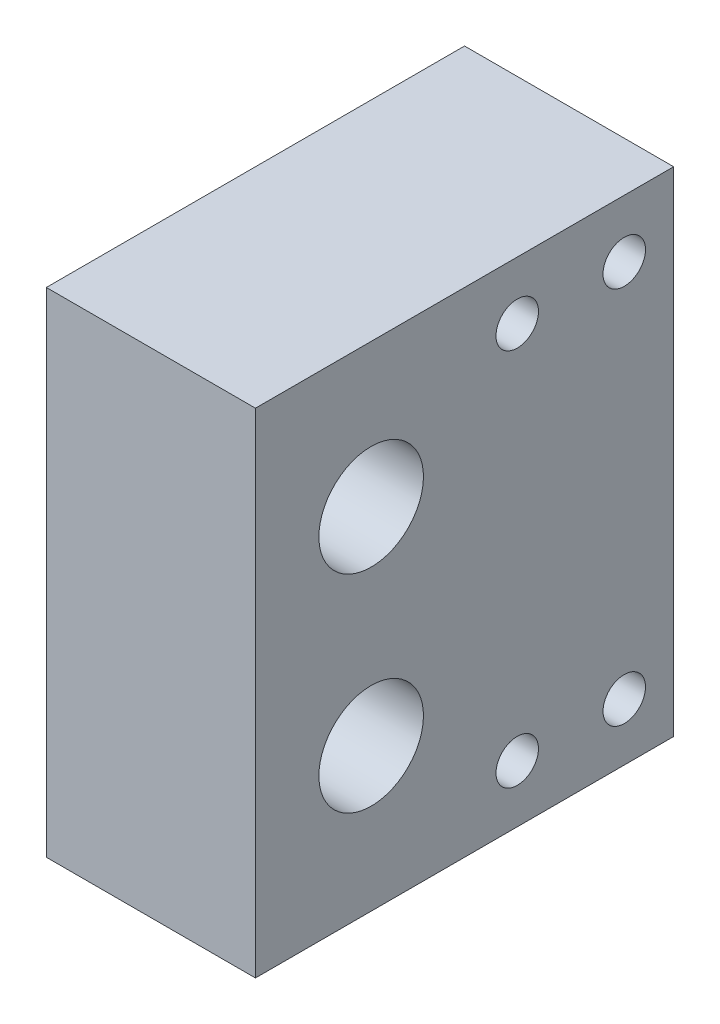
from build123d import *

# Parameters (mm, degrees)
SKETCH1_W           = 25.4
SKETCH1_H           = 59.944
BOSS_EXTRUDE1_DEPTH = 50.8
SKETCH2_OUTSIDE_W   = 69.316
SKETCH2_OUTSIDE_H   = 78.46
SKETCH2_OUTSIDE_W_2 = 50.8
SKETCH2_OUTSIDE_H_2 = 59.944
SKETCH2_OUTSIDE_R   = 2.5796875
CUT_EXTRUDE1_DEPTH  = 10.16
CUT_EXTRUDE2_REACH  = 66.219
SKETCH3_R           = 3.302
SKETCH4_R           = 6.35
CUT_EXTRUDE3_DEPTH  = 19.05


with BuildPart() as part:
    # Sketch1 → Boss-Extrude1 (new body)
    with BuildSketch(Plane.XY):
        Rectangle(SKETCH1_W, SKETCH1_H)
    extrude(amount=BOSS_EXTRUDE1_DEPTH)

    # Sketch2 outside → Cut-Extrude1 (cut)
    # profile 1 of 5: a face of its own
    with BuildSketch(Plane(origin=(12.7, 0, 0), x_dir=(0, 0, -1), z_dir=(1, 0, 0))):
        with Locations((-25.4, 0)):
            Rectangle(SKETCH2_OUTSIDE_W, SKETCH2_OUTSIDE_H)
        with Locations((-25.4, 0)):
            Rectangle(SKETCH2_OUTSIDE_W_2, SKETCH2_OUTSIDE_H_2, mode=Mode.SUBTRACT)
    # profile 2 of 5: a face of its own
    with BuildSketch(Plane(origin=(12.7, 0, 0), x_dir=(0, 0, -1), z_dir=(1, 0, 0))):
        with Locations(Location((-19, 22.972, 0), (0, 0, 90))):
            Circle(SKETCH2_OUTSIDE_R)
    # profile 3 of 5: a face of its own
    with BuildSketch(Plane(origin=(12.7, 0, 0), x_dir=(0, 0, -1), z_dir=(1, 0, 0))):
        with Locations(Location((-6, 22.972, 0), (0, 0, 90))):
            Circle(SKETCH2_OUTSIDE_R)
    # profile 4 of 5: a face of its own
    with BuildSketch(Plane(origin=(12.7, 0, 0), x_dir=(0, 0, -1), z_dir=(1, 0, 0))):
        with Locations(Location((-19, -23.028, 0), (0, 0, 90))):
            Circle(SKETCH2_OUTSIDE_R)
    # profile 5 of 5: a face of its own
    with BuildSketch(Plane(origin=(12.7, 0, 0), x_dir=(0, 0, -1), z_dir=(1, 0, 0))):
        with Locations(Location((-6, -23.028, 0), (0, 0, 90))):
            Circle(SKETCH2_OUTSIDE_R)
    extrude(amount=-CUT_EXTRUDE1_DEPTH, mode=Mode.SUBTRACT)

    # Sketch3 → Cut-Extrude2 (cut, up to next)
    with BuildSketch(Plane(origin=(12.7, 0, 0), x_dir=(0, 0, -1), z_dir=(1, 0, 0)), mode=Mode.PRIVATE) as cut_extrude2_sk1:
        with Locations(Location((-36.743794207, 12.573, 0), (0, 0, 90))):
            Circle(SKETCH3_R)
    cut_extrude2_tool1 = extrude(cut_extrude2_sk1.sketch, amount=-CUT_EXTRUDE2_REACH, mode=Mode.PRIVATE) & part.part
    # Sketch3 → Cut-Extrude2 (cut, up to next)
    with BuildSketch(Plane(origin=(12.7, 0, 0), x_dir=(0, 0, -1), z_dir=(1, 0, 0)), mode=Mode.PRIVATE) as cut_extrude2_sk2:
        with Locations(Location((-36.743794207, -12.573, 0), (0, 0, 90))):
            Circle(SKETCH3_R)
    cut_extrude2_tool2 = extrude(cut_extrude2_sk2.sketch, amount=-CUT_EXTRUDE2_REACH, mode=Mode.PRIVATE) & part.part
    add(cut_extrude2_tool1.solids().sort_by_distance((12.7, 12.573, 36.743794))[0], mode=Mode.SUBTRACT)
    add(cut_extrude2_tool2.solids().sort_by_distance((12.7, -12.573, 36.743794))[0], mode=Mode.SUBTRACT)

    # Sketch4 → Cut-Extrude3 (cut)
    with BuildSketch(Plane(origin=(12.7, 0, 0), x_dir=(0, 0, -1), z_dir=(1, 0, 0))):
        with Locations(Location((-36.743794207, 12.573, 0), (0, 0, 90))):
            Circle(SKETCH4_R)
        with Locations(Location((-36.743794207, -12.573, 0), (0, 0, 90))):
            Circle(SKETCH4_R)
    extrude(amount=-CUT_EXTRUDE3_DEPTH, mode=Mode.SUBTRACT)


solid = part.part
